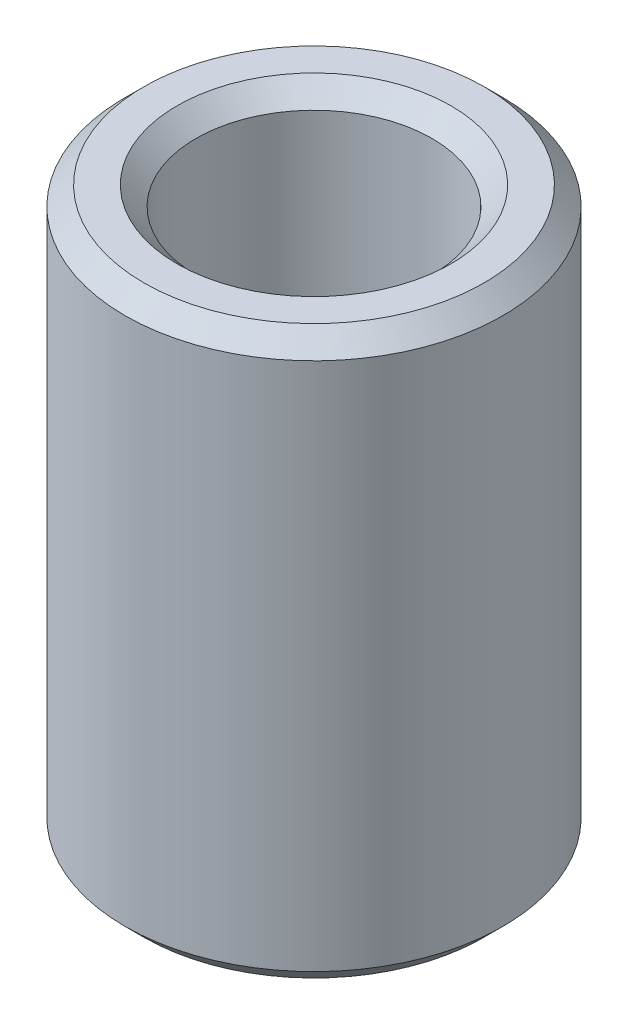
from build123d import *

# Parameters (mm, degrees)
IZIM1_R                     = 20
IZIM1_R_2                   = 12.5
Y_KSEKLIK_EKSTR_ZYON1_DEPTH = 60
PAH1_SIZE                   = 2


with BuildPart() as part:
    # Çizim1 → Yükseklik-Ekstrüzyon1 (new body)
    with BuildSketch(Plane(origin=(0, 0, 0), x_dir=(1, 0, 0), z_dir=(0, 1, 0))):
        with Locations(Location((0, 0, 0), (0, 0, 90))):
            Circle(IZIM1_R)
        with Locations(Location((0, 0, 0), (0, 0, 90))):
            Circle(IZIM1_R_2, mode=Mode.SUBTRACT)
    extrude(amount=Y_KSEKLIK_EKSTR_ZYON1_DEPTH)

    # Pah1
    pah1_edges = [part.edges().sort_by_distance(p)[0] for p in [
        (0, 0, 20),
        (0, 60, 20),
        (0, 0, 12.5),
        (0, 60, 12.5),
    ]]
    chamfer(pah1_edges, length=PAH1_SIZE)


solid = part.part
